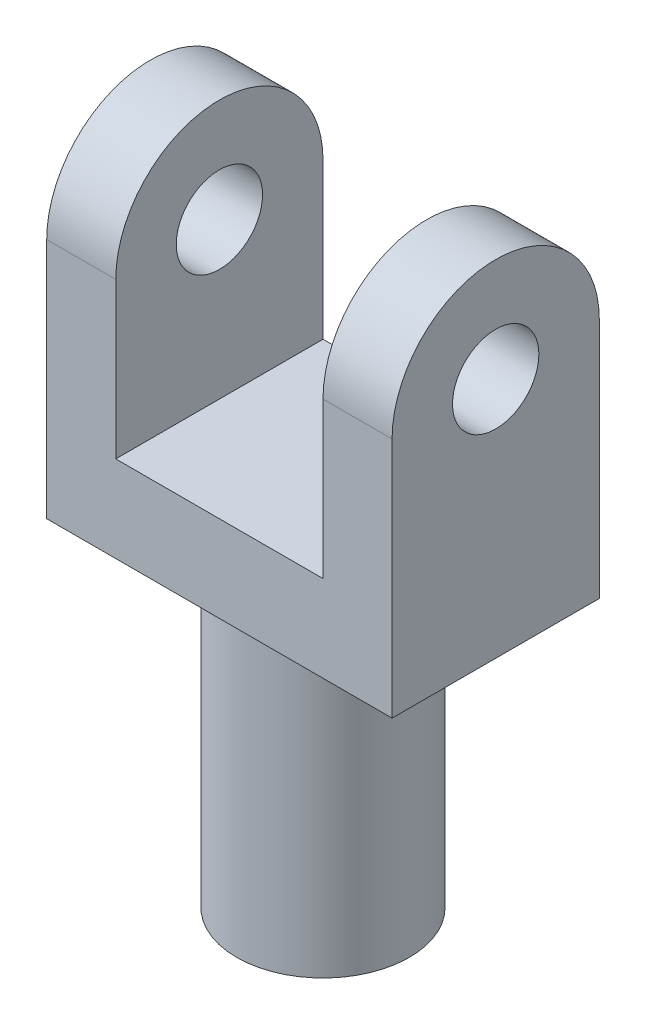
from build123d import *

# Parameters (mm, degrees)
SKETCH_1_R          = 10
EXTRUDE_1_DEPTH     = 35
SKETCH_2_W          = 40
SKETCH_2_H          = 24
EXTRUDE_2_DEPTH     = 10
EXTRUDE_3_DEPTH     = 8
EXTRUDE_4_DEPTH     = 8
SKETCH_5_R          = 5
CUT_EXTRUDE_1_DEPTH = 76
SKETCH_6_R          = 3.4
CUT_EXTRUDE_2_DEPTH = 20


with BuildPart() as part:
    # 草图1 → 凸台-拉伸1 (new body)
    with BuildSketch(Plane(origin=(0, 0, 0), x_dir=(1, 0, 0), z_dir=(0, 1, 0))):
        with Locations(Location((0, 0, 0), (0, 0, 270))):
            Circle(SKETCH_1_R)
    extrude(amount=EXTRUDE_1_DEPTH)

    # 草图2 → 凸台-拉伸2 (add)
    with BuildSketch(Plane(origin=(0, 35, 0), x_dir=(1, 0, 0), z_dir=(0, 1, 0))):
        Rectangle(SKETCH_2_W, SKETCH_2_H)
    extrude(amount=EXTRUDE_2_DEPTH)

    # 草图3 → 凸台-拉伸3 (add)
    with BuildSketch(Plane(origin=(12, 0, 0), x_dir=(0, 0, -1), z_dir=(1, 0, 0))):
        with BuildLine():
            Line((12, 45), (12, 63))
            ThreePointArc((12, 63), (0, 75), (-12, 63))
            Line((-12, 63), (-12, 45))
            Line((-12, 45), (12, 45))
        make_face()
    extrude(amount=EXTRUDE_3_DEPTH)

    # 草图4 → 凸台-拉伸4 (add)
    with BuildSketch(Plane(origin=(-20, 0, 0), x_dir=(0, 0, -1), z_dir=(1, 0, 0))):
        with BuildLine():
            Line((12, 45), (12, 63))
            ThreePointArc((12, 63), (0, 75), (-12, 63))
            Line((-12, 63), (-12, 45))
            Line((-12, 45), (12, 45))
        make_face()
    extrude(amount=EXTRUDE_4_DEPTH)

    # 草图5 → 切除-拉伸1 (cut, symmetric)
    with BuildSketch(Plane(origin=(-20, 0, 0), x_dir=(0, 0, -1), z_dir=(1, 0, 0))):
        with Locations((0, 63)):
            Circle(SKETCH_5_R)
    extrude(amount=CUT_EXTRUDE_1_DEPTH, both=True, mode=Mode.SUBTRACT)

    # 草图6 → 切除-拉伸2 (cut)
    with BuildSketch(Plane(origin=(0, 0, 0), x_dir=(1, 0, 0), z_dir=(0, 1, 0))):
        with Locations(Location((0, 0, 0), (0, 0, 270))):
            Circle(SKETCH_6_R)
    extrude(amount=CUT_EXTRUDE_2_DEPTH, mode=Mode.SUBTRACT)


solid = part.part
